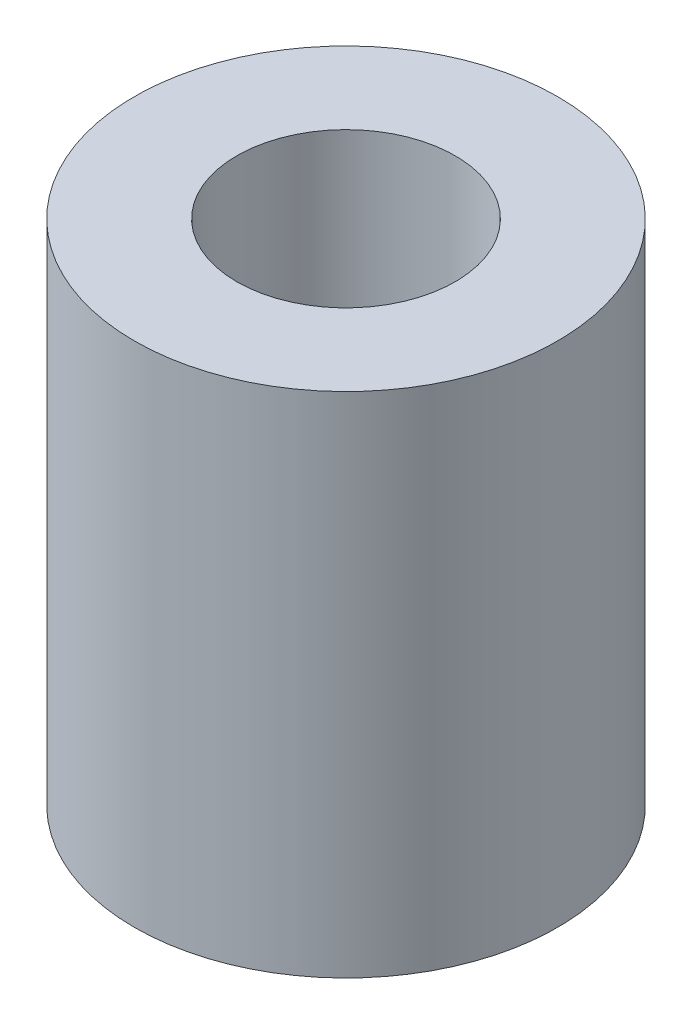
from build123d import *

# Parameters (mm, degrees)
SKETCH1_R           = 3.175
BOSS_EXTRUDE1_DEPTH = 7.62
SKETCH4_R           = 1.6383
CUT_EXTRUDE1_DEPTH  = 5.08


with BuildPart() as part:
    # Sketch1 → Boss-Extrude1 (new body)
    with BuildSketch(Plane(origin=(0, 0, 0), x_dir=(1, 0, 0), z_dir=(0, 1, 0))):
        with Locations(Location((0, 0, 0), (0, 0, 90))):
            Circle(SKETCH1_R)
    extrude(amount=BOSS_EXTRUDE1_DEPTH)

    # Sketch4 → Cut-Extrude1 (cut)
    with BuildSketch(Plane(origin=(0, 7.62, 0), x_dir=(1, 0, 0), z_dir=(0, 1, 0))):
        with Locations(Location((0, 0, 0), (0, 0, 270))):
            Circle(SKETCH4_R)
    extrude(amount=-CUT_EXTRUDE1_DEPTH, mode=Mode.SUBTRACT)


solid = part.part
